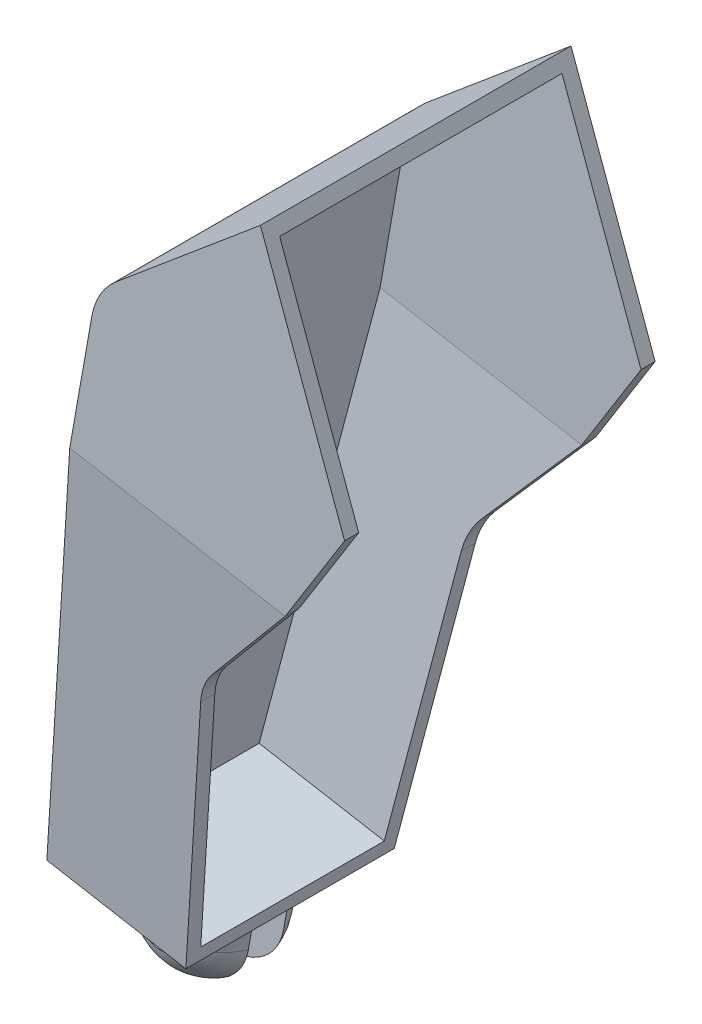
from build123d import *

# Parameters (mm, degrees)
EXTRUDE_1_DEPTH     = 20
CUT_EXTRUDE_1_DEPTH = 2
EXTRUDE_START       = 2
EXTRUDE_2_DEPTH     = 2
EXTRUDE_3_DEPTH     = 33
CUT_EXTRUDE_4_DEPTH = 22.5
EXTRUDE_5_DEPTH     = 20
SKETCH_11_R         = 8
EXTRUDE_6_DEPTH     = 6
SKETCH_13_W         = 5
SKETCH_13_H         = 22.035528512
CUT_EXTRUDE_5_DEPTH = 40
SKETCH_14_R         = 2.5
CUT_EXTRUDE_6_DEPTH = 20


with BuildPart() as part:
    # 草图1 → 凸台-拉伸1 (new, symmetric)
    with BuildSketch(Plane.XY):
        with BuildLine():
            Line((14.229470778, 51.299168583), (-6.23969278, 34.123500992))
            ThreePointArc((-6.23969278, 34.123500992), (-8.472070721, 31.463056561), (-9.659894213, 28.199538337))
            Line((-9.659894213, 28.199538337), (-22.919720748, -47.000674818))
            Line((-22.919720748, -47.000674818), (-20.950105242, -47.347971173))
            Line((-20.950105242, -47.347971173), (-7.816684243, 27.135360565))
            ThreePointArc((-7.816684243, 27.135360565), (-6.628860751, 30.398878788), (-4.39648281, 33.059323219))
            Line((-4.39648281, 33.059323219), (14.957411246, 49.299168583))
            Line((14.957411246, 49.299168583), (14.229470778, 51.299168583))
        make_face()
    extrude(amount=EXTRUDE_1_DEPTH, both=True)

    # 草图3 → 切除-拉伸1 (cut)
    with BuildSketch(Plane(origin=(-14.191017833, 2.502259328, 0), x_dir=(0, 0, 1), z_dir=(-0.9848077530122074, 0.17364817766693458, 0))):
        Polygon((13, -50.266596698), (20, -50.266596698), (20, 8.093700959), align=None)
    cut_extrude_1 = extrude(amount=-CUT_EXTRUDE_1_DEPTH, mode=Mode.SUBTRACT)

    # 镜向1: 切除-拉伸1 across plane
    add(cut_extrude_1.mirror(Plane.XY), mode=Mode.SUBTRACT)

    # 草图4 → 凸台-拉伸2 (add)
    with BuildSketch(Plane.XY.offset(20).offset(EXTRUDE_START)):
        with BuildLine():
            Line((-12.785561411, 10.472998783), (17.743478932, 5.089905275))
            Line((17.743478932, 5.089905275), (26.15106548, 18.544856334))
            Line((26.15106548, 18.544856334), (14.229470778, 51.299168583))
            Line((14.229470778, 51.299168583), (-6.23969278, 34.123500992))
            ThreePointArc((-6.23969278, 34.123500992), (-8.472070721, 31.463056561), (-9.659894213, 28.199538337))
            Line((-9.659894213, 28.199538337), (-12.785561411, 10.472998783))
        make_face()
    extrude_2 = extrude(amount=-EXTRUDE_2_DEPTH)

    # 草图5 → 凸台-拉伸3 (add)
    with BuildSketch(Plane(origin=(-14.191017833, 2.502259328, 0), x_dir=(0, 0, 1), z_dir=(-0.9848077530122074, 0.17364817766693458, 0))):
        Polygon((22, 8.093700959), (15, -50.266596698), (13, -50.266596698), (20, 8.093700959), align=None)
    extrude_3 = extrude(amount=-EXTRUDE_3_DEPTH)

    # 镜向3: 凸台-拉伸2, 凸台-拉伸3 across plane
    add(extrude_2.mirror(Plane.XY))
    add(extrude_3.mirror(Plane.XY))

    # 草图8 → 切除-拉伸4 (cut, symmetric)
    with BuildSketch(Plane.XY):
        with BuildLine():
            Line((17.743478932, 5.089905275), (5.494596432, -9.126276461))
            ThreePointArc((5.494596432, -9.126276461), (4.035122352, -11.368395051), (3.222317206, -13.917219909))
            Line((3.222317206, -13.917219909), (-3.223565687, -50.473638371))
            Line((-3.223565687, -50.473638371), (21.878971758, -54.899893007))
            Line((21.878971758, -54.899893007), (32.013131095, 2.573780594))
            Line((32.013131095, 2.573780594), (17.743478932, 5.089905275))
        make_face()
    extrude(amount=CUT_EXTRUDE_4_DEPTH, both=True, mode=Mode.SUBTRACT)

    # 草图10 → 凸台-拉伸5 (add)
    with BuildSketch(Plane(origin=(-14.191017833, 2.502259328, 0), x_dir=(0, 0, 1), z_dir=(-0.9848077530122074, 0.17364817766693458, 0))):
        Polygon((-15, -50.266596698), (15, -50.266596698), (14.760110888, -52.266596698), (-14.760110888, -52.266596698), align=None)
    extrude(amount=-EXTRUDE_5_DEPTH)

    # 草图11 → 凸台-拉伸6 (add)
    with BuildSketch(Plane(origin=(-9.075999269, -51.472549652, 0), x_dir=(0.9848077530122074, -0.17364817766693455, 0), z_dir=(-0.17364817766693455, -0.9848077530122074, 0))):
        with Locations(Location((-4.409937158, 0, 0), (0, 0, 180))):
            Circle(SKETCH_11_R)
    extrude(amount=EXTRUDE_6_DEPTH)

    # 草图12 → 旋转1 (revolve)
    with BuildSketch(Plane.XY, mode=Mode.PRIVATE) as revolve_1_sk:
        with BuildLine():
            Line((-14.460828639, -56.615618619), (-6.582366615, -58.00480404))
            ThreePointArc((-6.582366615, -58.00480404), (-9.872217148, -63.168834973), (-15.85001406, -64.494080643))
            Line((-15.85001406, -64.494080643), (-14.460828639, -56.615618619))
        make_face()
    revolve(revolve_1_sk.sketch.rotate(Axis((-14.460828639, -56.615618619, 0), (-0.17364817766693416, -0.9848077530122075, 0)), 180), axis=Axis((-14.460828639, -56.615618619, 0), (-0.17364817766693416, -0.9848077530122075, 0)))

    # 草图13 → 切除-拉伸5 (cut)
    with BuildSketch(Plane(origin=(-14.191017833, 2.502259328, 0), x_dir=(0, 0, 1), z_dir=(-0.9848077530122074, 0.17364817766693458, 0))):
        with Locations((0, -63.284360954)):
            Rectangle(SKETCH_13_W, SKETCH_13_H)
    extrude(amount=-CUT_EXTRUDE_5_DEPTH, mode=Mode.SUBTRACT)

    # 草图14 → 切除-拉伸6 (cut, symmetric)
    with BuildSketch(Plane.XY):
        with Locations(Location((-14.460828639, -56.615618619, 0), (0, 0, 350))):
            Circle(SKETCH_14_R)
    extrude(amount=CUT_EXTRUDE_6_DEPTH, both=True, mode=Mode.SUBTRACT)


solid = part.part
